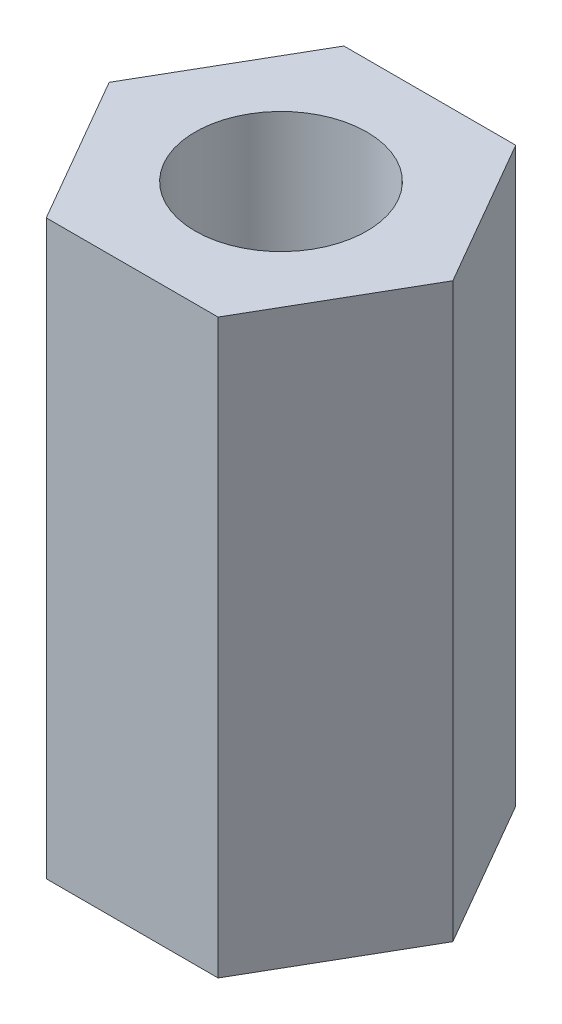
from build123d import *

# Parameters (mm, degrees)
SKETCH_1_R      = 1.5
EXTRUDE_1_DEPTH = 10


with BuildPart() as part:
    # 스케치1 → 보스-돌출1 (new body)
    with BuildSketch(Plane(origin=(0, 0, 0), x_dir=(1, 0, 0), z_dir=(0, 1, 0))):
        Polygon((1.5011107, 2.6), (-1.5011107, 2.6), (-3.0022214, 0), (-1.5011107, -2.6), (1.5011107, -2.6), (3.0022214, 0), align=None)
        with Locations(Location((0, 0, 0), (0, 0, 270))):
            Circle(SKETCH_1_R, mode=Mode.SUBTRACT)
    extrude(amount=EXTRUDE_1_DEPTH)


solid = part.part
